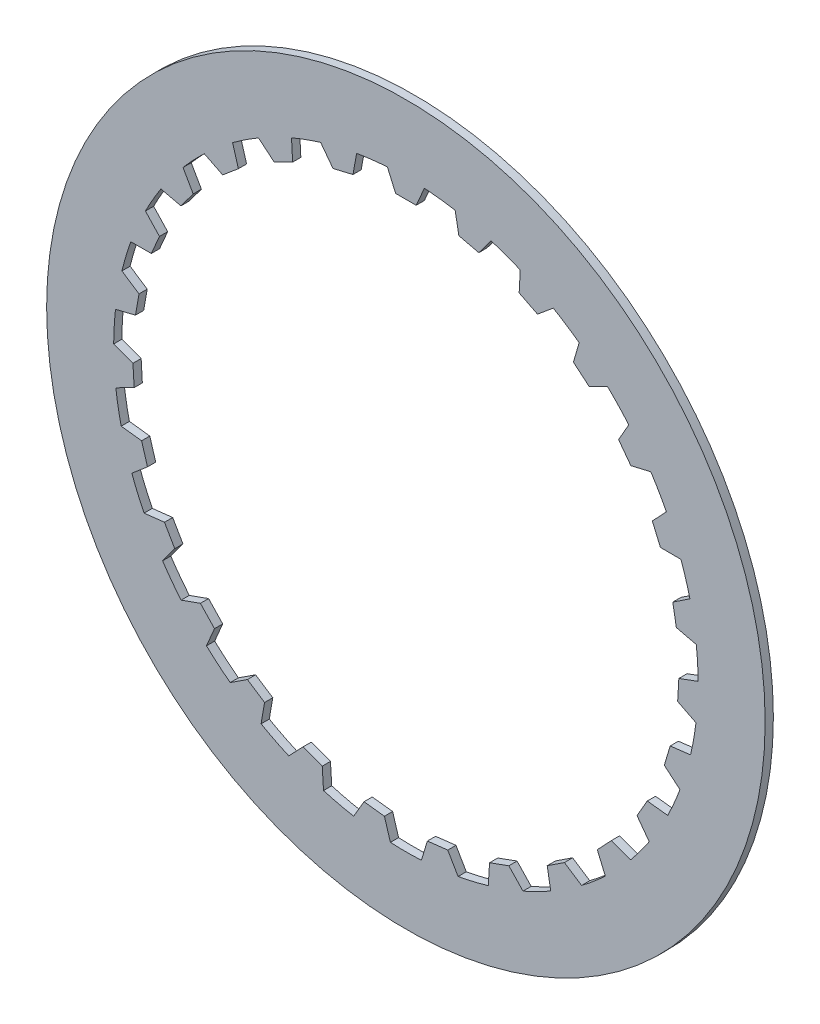
from build123d import *

# Parameters (mm, degrees)
SKETCH1_R           = 66.675
BOSS_EXTRUDE1_DEPTH = 1.524


with BuildPart() as part:
    # Sketch1 → Boss-Extrude1 (new body)
    with BuildSketch(Plane.XY):
        with Locations(Location((0, 0, 0), (0, 0, 180))):
            Circle(SKETCH1_R)
        with BuildLine():
            Line((-3.429, 54.120480412), (-1.905, 50.628557732))
            Line((-1.905, 50.628557732), (1.905, 50.628557732))
            Line((1.905, 50.628557732), (3.429, 54.120480412))
            ThreePointArc((3.429, 54.120480412), (6.29560264, 53.862322902), (9.144470854, 53.452437679))
            Line((9.144470854, 53.452437679), (9.822098447, 49.70318164))
            Line((9.822098447, 49.70318164), (13.529399404, 48.824535172))
            Line((13.529399404, 48.824535172), (15.817612576, 51.870874037))
            ThreePointArc((15.817612576, 51.870874037), (18.547410352, 50.958591133), (21.224960917, 49.902760195))
            Line((21.224960917, 49.902760195), (21.019685025, 46.09829416))
            Line((21.019685025, 46.09829416), (24.424425385, 44.388369284))
            Line((24.424425385, 44.388369284), (27.353493565, 46.824895417))
            ThreePointArc((27.353493565, 46.824895417), (29.799322372, 45.307668525), (32.161207844, 43.662811992))
            Line((32.161207844, 43.662811992), (31.084094942, 40.00823571))
            Line((31.084094942, 40.00823571), (34.002724271, 37.559214917))
            Line((34.002724271, 37.559214917), (37.414740634, 39.254574565))
            ThreePointArc((37.414740634, 39.254574565), (39.444745209, 37.21419778), (41.36363573, 35.068990293))
            Line((41.36363573, 35.068990293), (39.472753256, 31.761322918))
            Line((39.472753256, 31.761322918), (41.74792749, 28.705233553))
            Line((41.74792749, 28.705233553), (45.458949352, 29.568029437))
            ThreePointArc((45.458949352, 29.568029437), (46.963691622, 27.1145), (48.336139308, 24.58459025))
            Line((48.336139308, 24.58459025), (45.733425224, 21.802148985))
            Line((45.733425224, 21.802148985), (47.242489132, 18.303745618))
            Line((47.242489132, 18.303745618), (51.052454344, 18.287464189))
            ThreePointArc((51.052454344, 18.287464189), (51.950813263, 15.553052507), (52.702829105, 12.774828583))
            Line((52.702829105, 12.774828583), (49.5285964, 10.667615558))
            Line((49.5285964, 10.667615558), (50.190195957, 6.915498019))
            Line((50.190195957, 6.915498019), (53.893708307, 6.021017013))
            ThreePointArc((53.893708307, 6.021017013), (54.137253115, 3.153135927), (54.228295743, 0.276372601))
            Line((54.228295743, 0.276372601), (50.653668125, -1.042011786))
            Line((50.653668125, -1.042011786), (50.432136326, -4.845565869))
            Line((50.432136326, -4.845565869), (53.829538506, -6.570024749))
            ThreePointArc((53.829538506, -6.570024749), (53.405139638, -9.416767027), (52.830300921, -12.2369827))
            Line((52.830300921, -12.2369827), (49.047987489, -12.695464004))
            Line((49.047987489, -12.695464004), (47.955267173, -16.345404046))
            Line((47.955267173, -16.345404046), (50.863404351, -18.806874776))
            ThreePointArc((50.863404351, -18.806874776), (49.79394126, -21.479009633), (48.584210902, -24.090639096))
            Line((48.584210902, -24.090639096), (44.798117153, -23.664500472))
            Line((44.798117153, -23.664500472), (42.893117153, -26.96405726))
            Line((42.893117153, -26.96405726), (45.155210902, -30.029841315))
            ThreePointArc((45.155210902, -30.029841315), (43.49833862, -32.383313269), (41.718933497, -34.645562903))
            Line((41.718933497, -34.645562903), (38.133168725, -33.357777594))
            Line((38.133168725, -33.357777594), (35.518588085, -36.129071168))
            Line((35.518588085, -36.129071168), (37.012688345, -39.633891337))
            ThreePointArc((37.012688345, -39.633891337), (34.857729286, -41.541824106), (32.604577589, -43.332735446))
            Line((32.604577589, -43.332735446), (29.412451301, -41.252728291))
            Line((29.412451301, -41.252728291), (26.22924274, -43.346357498))
            Line((26.22924274, -43.346357498), (26.874802178, -47.101268018))
            ThreePointArc((26.874802178, -47.101268018), (24.337930743, -48.460804452), (21.732500464, -49.683829005))
            Line((21.732500464, -49.683829005), (19.106101015, -46.923733729))
            Line((19.106101015, -46.923733729), (15.525872129, -48.226830475))
            Line((15.525872129, -48.226830475), (15.288088471, -52.029403148))
            ThreePointArc((15.288088471, -52.029403148), (12.506068054, -52.767250287), (9.688818614, -53.356454482))
            Line((9.688818614, -53.356454482), (7.769735877, -50.065068535))
            Line((7.769735877, -50.065068535), (3.985497734, -50.507382538))
            Line((3.985497734, -50.507382538), (2.877189956, -54.152619687))
            ThreePointArc((2.877189956, -54.152619687), (0, -54.229), (-2.877189956, -54.152619687))
            Line((-2.877189956, -54.152619687), (-3.985497734, -50.507382538))
            Line((-3.985497734, -50.507382538), (-7.769735877, -50.065068535))
            Line((-7.769735877, -50.065068535), (-9.688818614, -53.356454482))
            ThreePointArc((-9.688818614, -53.356454482), (-12.506068054, -52.767250287), (-15.288088471, -52.029403148))
            Line((-15.288088471, -52.029403148), (-15.525872129, -48.226830475))
            Line((-15.525872129, -48.226830475), (-19.106101015, -46.923733729))
            Line((-19.106101015, -46.923733729), (-21.732500464, -49.683829005))
            ThreePointArc((-21.732500464, -49.683829005), (-24.337930743, -48.460804452), (-26.874802178, -47.101268018))
            Line((-26.874802178, -47.101268018), (-26.22924274, -43.346357498))
            Line((-26.22924274, -43.346357498), (-29.412451301, -41.252728291))
            Line((-29.412451301, -41.252728291), (-32.604577589, -43.332735446))
            ThreePointArc((-32.604577589, -43.332735446), (-34.857729286, -41.541824106), (-37.012688345, -39.633891337))
            Line((-37.012688345, -39.633891337), (-35.518588085, -36.129071168))
            Line((-35.518588085, -36.129071168), (-38.133168725, -33.357777594))
            Line((-38.133168725, -33.357777594), (-41.718933497, -34.645562903))
            ThreePointArc((-41.718933497, -34.645562903), (-43.49833862, -32.383313269), (-45.155210902, -30.029841315))
            Line((-45.155210902, -30.029841315), (-42.893117153, -26.96405726))
            Line((-42.893117153, -26.96405726), (-44.798117153, -23.664500472))
            Line((-44.798117153, -23.664500472), (-48.584210902, -24.090639096))
            ThreePointArc((-48.584210902, -24.090639096), (-49.79394126, -21.479009633), (-50.863404351, -18.806874776))
            Line((-50.863404351, -18.806874776), (-47.955267173, -16.345404046))
            Line((-47.955267173, -16.345404046), (-49.047987489, -12.695464004))
            Line((-49.047987489, -12.695464004), (-52.830300921, -12.2369827))
            ThreePointArc((-52.830300921, -12.2369827), (-53.405139638, -9.416767027), (-53.829538506, -6.570024749))
            Line((-53.829538506, -6.570024749), (-50.432136326, -4.845565869))
            Line((-50.432136326, -4.845565869), (-50.653668125, -1.042011786))
            Line((-50.653668125, -1.042011786), (-54.228295743, 0.276372601))
            ThreePointArc((-54.228295743, 0.276372601), (-54.137253115, 3.153135927), (-53.893708307, 6.021017013))
            Line((-53.893708307, 6.021017013), (-50.190195957, 6.915498019))
            Line((-50.190195957, 6.915498019), (-49.5285964, 10.667615558))
            Line((-49.5285964, 10.667615558), (-52.702829105, 12.774828583))
            ThreePointArc((-52.702829105, 12.774828583), (-51.950813263, 15.553052507), (-51.052454344, 18.287464189))
            Line((-51.052454344, 18.287464189), (-47.242489132, 18.303745618))
            Line((-47.242489132, 18.303745618), (-45.733425224, 21.802148985))
            Line((-45.733425224, 21.802148985), (-48.336139308, 24.58459025))
            ThreePointArc((-48.336139308, 24.58459025), (-46.963691622, 27.1145), (-45.458949352, 29.568029437))
            Line((-45.458949352, 29.568029437), (-41.74792749, 28.705233553))
            Line((-41.74792749, 28.705233553), (-39.472753256, 31.761322918))
            Line((-39.472753256, 31.761322918), (-41.36363573, 35.068990293))
            ThreePointArc((-41.36363573, 35.068990293), (-39.444745209, 37.21419778), (-37.414740634, 39.254574565))
            Line((-37.414740634, 39.254574565), (-34.002724271, 37.559214917))
            Line((-34.002724271, 37.559214917), (-31.084094942, 40.00823571))
            Line((-31.084094942, 40.00823571), (-32.161207844, 43.662811992))
            ThreePointArc((-32.161207844, 43.662811992), (-29.799322372, 45.307668525), (-27.353493565, 46.824895417))
            Line((-27.353493565, 46.824895417), (-24.424425385, 44.388369284))
            Line((-24.424425385, 44.388369284), (-21.019685025, 46.09829416))
            Line((-21.019685025, 46.09829416), (-21.224960917, 49.902760195))
            ThreePointArc((-21.224960917, 49.902760195), (-18.547410352, 50.958591133), (-15.817612576, 51.870874037))
            Line((-15.817612576, 51.870874037), (-13.529399404, 48.824535172))
            Line((-13.529399404, 48.824535172), (-9.822098447, 49.70318164))
            Line((-9.822098447, 49.70318164), (-9.144470854, 53.452437679))
            ThreePointArc((-9.144470854, 53.452437679), (-6.29560264, 53.862322902), (-3.429, 54.120480412))
        make_face(mode=Mode.SUBTRACT)
    extrude(amount=BOSS_EXTRUDE1_DEPTH)


solid = part.part
